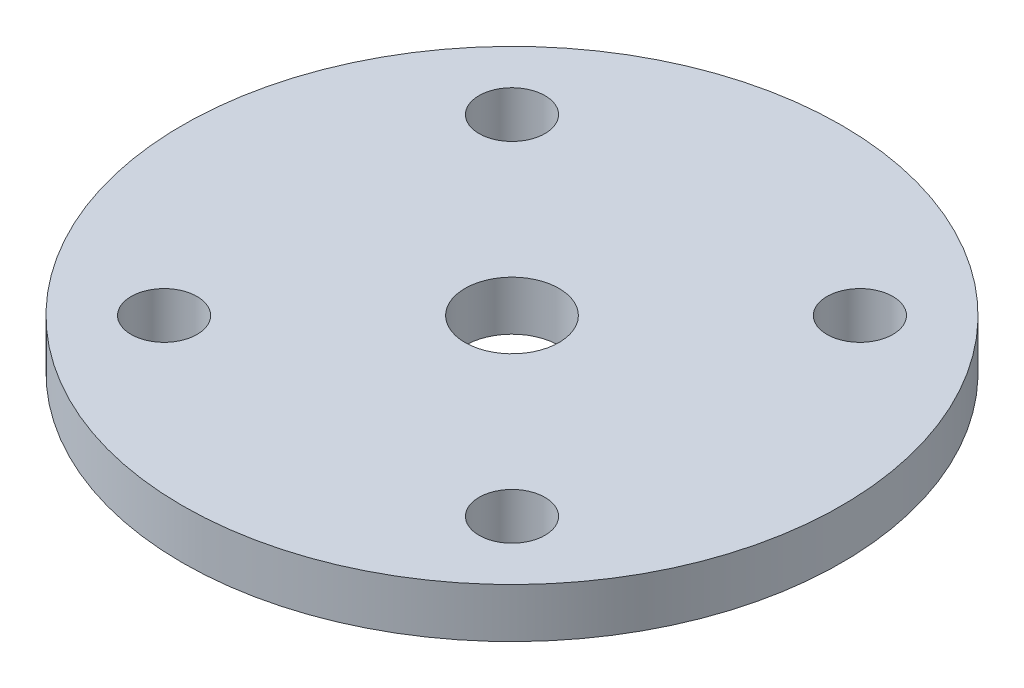
from build123d import *

# Parameters (mm, degrees)
ESBO_O1_R                = 20
ESBO_O1_R_2              = 2.85
ESBO_O1_R_3              = 2
RESSALTO_EXTRUS_O1_DEPTH = 3


with BuildPart() as part:
    # Esboço1 → Ressalto-extrusão1 (new body)
    with BuildSketch(Plane.XZ.offset(3)):
        with Locations(Location((0, 0, 0), (0, 0, 90))):
            Circle(ESBO_O1_R)
        with Locations(Location((0, 0, 0), (0, 0, 90))):
            Circle(ESBO_O1_R_2, mode=Mode.SUBTRACT)
        with Locations(Location((10.557104243, 10.557104243, 0), (0, 0, 90))):
            Circle(ESBO_O1_R_3, mode=Mode.SUBTRACT)
        with Locations(Location((10.557104243, -10.557104243, 0), (0, 0, 90))):
            Circle(ESBO_O1_R_3, mode=Mode.SUBTRACT)
        with Locations(Location((-10.557104243, -10.557104243, 0), (0, 0, 90))):
            Circle(ESBO_O1_R_3, mode=Mode.SUBTRACT)
        with Locations(Location((-10.557104243, 10.557104243, 0), (0, 0, 90))):
            Circle(ESBO_O1_R_3, mode=Mode.SUBTRACT)
    extrude(amount=-RESSALTO_EXTRUS_O1_DEPTH)


solid = part.part
